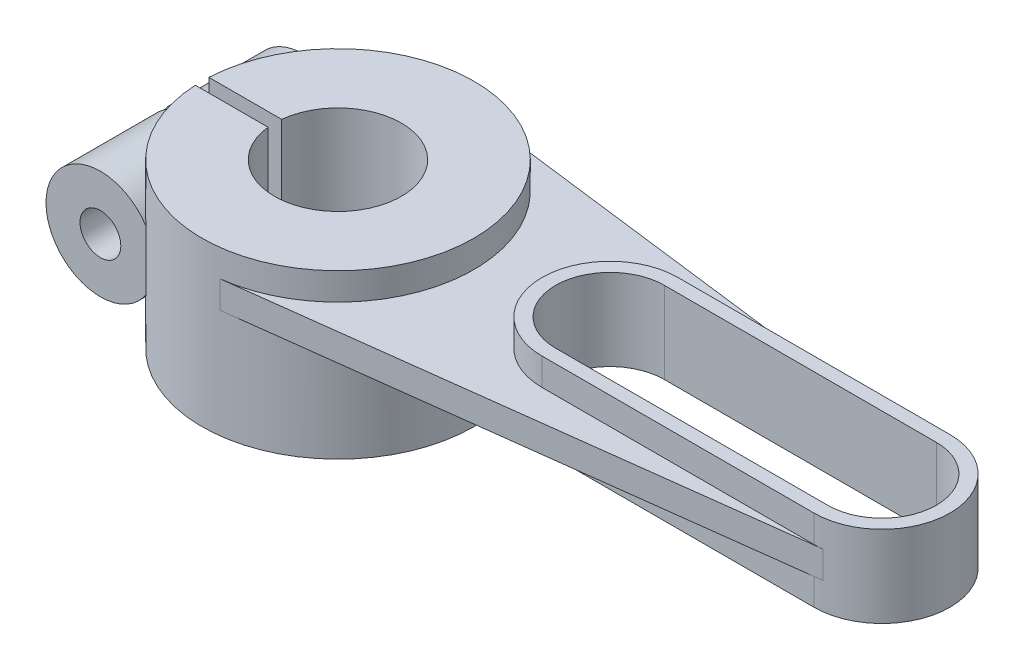
from build123d import *

# Parameters (mm, degrees)
SKETCH1_R           = 30
SKETCH1_R_2         = 14
BOSS_EXTRUDE1_DEPTH = 36
BOSS_EXTRUDE2_DEPTH = 18
BOSS_EXTRUDE3_START = -12
BOSS_EXTRUDE3_DEPTH = 6
CUT_EXTRUDE1_DEPTH  = 143.902064366
SKETCH5_R           = 12
BOSS_EXTRUDE4_DEPTH = 22.4
CUT_EXTRUDE2_DEPTH  = 143.902064412
HOLE1_D             = 9


with BuildPart() as part:
    # Sketch1 → Boss-Extrude1 (new body)
    with BuildSketch(Plane(origin=(0, 0, 0), x_dir=(1, 0, 0), z_dir=(0, 1, 0))):
        with Locations(Location((0, 0, 0), (0, 0, 270))):
            Circle(SKETCH1_R)
        with Locations(Location((0, 0, 0), (0, 0, 270))):
            Circle(SKETCH1_R_2, mode=Mode.SUBTRACT)
    extrude(amount=BOSS_EXTRUDE1_DEPTH)



with BuildPart() as body_2:
    # Sketch2 → Boss-Extrude2 (new body)
    with BuildSketch(Plane(origin=(0, 36, 0), x_dir=(1, 0, 0), z_dir=(0, 1, 0))):
        with BuildLine():
            Line((60, 15), (120, 15))
            ThreePointArc((120, 15), (135, 0), (120, -15))
            Line((120, -15), (60, -15))
            ThreePointArc((60, -15), (45, 0), (60, 15))
        make_face()
    extrude(amount=-BOSS_EXTRUDE2_DEPTH)


with BuildPart() as part_1:
    add(part.part)

    add(body_2.part)  # Boss-Extrude3 merges body 2
    # Sketch3 → Boss-Extrude3 (add)
    with BuildSketch(Plane(origin=(0, 36, 0), x_dir=(1, 0, 0), z_dir=(0, 1, 0)).offset(BOSS_EXTRUDE3_START)):
        with BuildLine():
            Line((3.75, -29.764702249), (121.875, -14.882351125))
            ThreePointArc((121.875, -14.882351125), (135, 0), (121.875, 14.882351125))
            Line((121.875, 14.882351125), (3.75, 29.764702249))
            ThreePointArc((3.75, 29.764702249), (30, 0), (3.75, -29.764702249))
        make_face()
    extrude(amount=BOSS_EXTRUDE3_DEPTH)

    # Sketch4 → Cut-Extrude1 (cut, through all)
    with BuildSketch(Plane(origin=(0, 36, 0), x_dir=(1, 0, 0), z_dir=(0, 1, 0))):
        with BuildLine():
            Line((60, 12), (120, 12))
            ThreePointArc((120, 12), (132, 0), (120, -12))
            Line((120, -12), (60, -12))
            ThreePointArc((60, -12), (48, 0), (60, 12))
        make_face()
    extrude(amount=-CUT_EXTRUDE1_DEPTH, mode=Mode.SUBTRACT)

    # Sketch5 → Boss-Extrude4 (add, symmetric)
    with BuildSketch(Plane.XY):
        with Locations((-30, 18)):
            Circle(SKETCH5_R)
    extrude(amount=BOSS_EXTRUDE4_DEPTH, both=True)

    # Sketch6 → Cut-Extrude2 (cut, through all)
    with BuildSketch(Plane(origin=(0, 36, 0), x_dir=(1, 0, 0), z_dir=(0, 1, 0))):
        with BuildLine():
            Line((-45, 1.5), (-13.919410907, 1.5))
            ThreePointArc((-13.919410907, 1.5), (-14, 0), (-13.919410907, -1.5))
            Line((-13.919410907, -1.5), (-45, -1.5))
            Line((-45, -1.5), (-45, 1.5))
        make_face()
    extrude(amount=-CUT_EXTRUDE2_DEPTH, mode=Mode.SUBTRACT)

    # Hole1 (through all)
    with Locations(Plane.XY.offset(22.4)):
        with Locations((-30, 18)):
            Hole(HOLE1_D / 2)


solid = part_1.part
